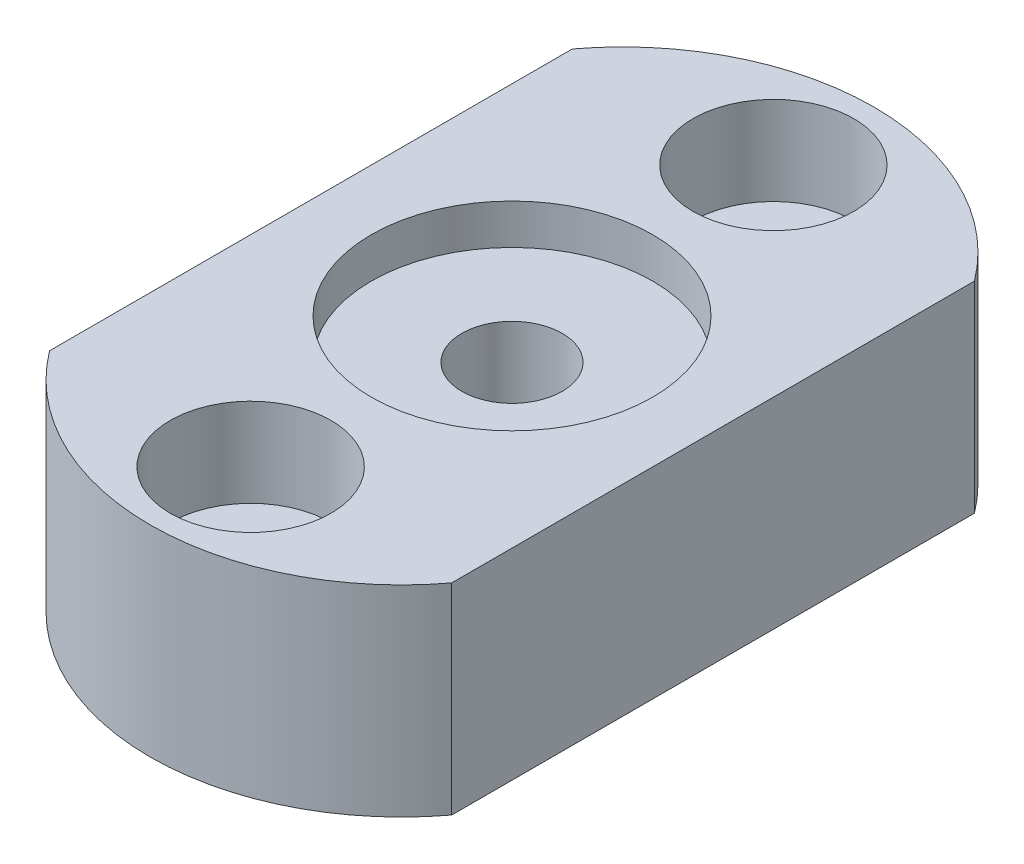
from build123d import *

# Parameters (mm, degrees)
BOSS_EXTRUDE1_DEPTH = 10
SKETCH2_R           = 4
CUT_EXTRUDE1_DEPTH  = 4.4
CUT_EXTRUDE2_REACH  = 23.339
SKETCH3_R           = 2.15
SKETCH4_R           = 7
CUT_EXTRUDE3_DEPTH  = 2
CUT_EXTRUDE4_REACH  = 24.091
SKETCH5_R           = 2.5
CUT_EXTRUDE5_START  = -2
SKETCH6_R           = 7
CUT_EXTRUDE5_DEPTH  = 2


with BuildPart() as part:
    # Sketch1 → Boss-Extrude1 (new body)
    with BuildSketch(Plane(origin=(0, 0, 0), x_dir=(1, 0, 0), z_dir=(0, 1, 0))):
        with BuildLine():
            Line((-10, 13), (-10, -13))
            ThreePointArc((-10, -13), (0, -18), (10, -13))
            Line((10, -13), (10, 13))
            ThreePointArc((10, 13), (0, 18), (-10, 13))
        make_face()
    extrude(amount=BOSS_EXTRUDE1_DEPTH)

    # Sketch2 → Cut-Extrude1 (cut)
    with BuildSketch(Plane(origin=(0, 10, 0), x_dir=(1, 0, 0), z_dir=(0, 1, 0))):
        with Locations(Location((0, 13, 0), (0, 0, 270))):
            Circle(SKETCH2_R)
        with Locations(Location((0, -13, 0), (0, 0, 270))):
            Circle(SKETCH2_R)
    extrude(amount=-CUT_EXTRUDE1_DEPTH, mode=Mode.SUBTRACT)

    # Sketch3 → Cut-Extrude2 (cut, up to next)
    with BuildSketch(Plane(origin=(0, 5.6, 0), x_dir=(1, 0, 0), z_dir=(0, 1, 0)), mode=Mode.PRIVATE) as cut_extrude2_sk1:
        with Locations(Location((0, 13, 0), (0, 0, 270))):
            Circle(SKETCH3_R)
    cut_extrude2_tool1 = extrude(cut_extrude2_sk1.sketch, amount=-CUT_EXTRUDE2_REACH, mode=Mode.PRIVATE) & part.part
    # Sketch3 → Cut-Extrude2 (cut, up to next)
    with BuildSketch(Plane(origin=(0, 5.6, 0), x_dir=(1, 0, 0), z_dir=(0, 1, 0)), mode=Mode.PRIVATE) as cut_extrude2_sk2:
        with Locations(Location((0, -13, 0), (0, 0, 270))):
            Circle(SKETCH3_R)
    cut_extrude2_tool2 = extrude(cut_extrude2_sk2.sketch, amount=-CUT_EXTRUDE2_REACH, mode=Mode.PRIVATE) & part.part
    add(cut_extrude2_tool1.solids().sort_by_distance((0, 5.6, -13))[0], mode=Mode.SUBTRACT)
    add(cut_extrude2_tool2.solids().sort_by_distance((0, 5.6, 13))[0], mode=Mode.SUBTRACT)

    # Sketch4 → Cut-Extrude3 (cut)
    with BuildSketch(Plane(origin=(0, 10, 0), x_dir=(1, 0, 0), z_dir=(0, 1, 0))):
        with Locations(Location((0, 0, 0), (0, 0, 270))):
            Circle(SKETCH4_R)
    extrude(amount=-CUT_EXTRUDE3_DEPTH, mode=Mode.SUBTRACT)

    # Sketch5 → Cut-Extrude4 (cut, up to next)
    with BuildSketch(Plane(origin=(0, 8, 0), x_dir=(1, 0, 0), z_dir=(0, 1, 0)), mode=Mode.PRIVATE) as cut_extrude4_sk1:
        with Locations(Location((0, 0, 0), (0, 0, 270))):
            Circle(SKETCH5_R)
    cut_extrude4_tool1 = extrude(cut_extrude4_sk1.sketch, amount=-CUT_EXTRUDE4_REACH, mode=Mode.PRIVATE) & part.part
    add(cut_extrude4_tool1.solids().sort_by_distance((0, 8, 0))[0], mode=Mode.SUBTRACT)

    # Sketch6 → Cut-Extrude5 (cut)
    with BuildSketch(Plane.XZ.offset(CUT_EXTRUDE5_START)):
        with Locations(Location((0, 0, 0), (0, 0, 90))):
            Circle(SKETCH6_R)
    extrude(amount=CUT_EXTRUDE5_DEPTH, mode=Mode.SUBTRACT)


solid = part.part
